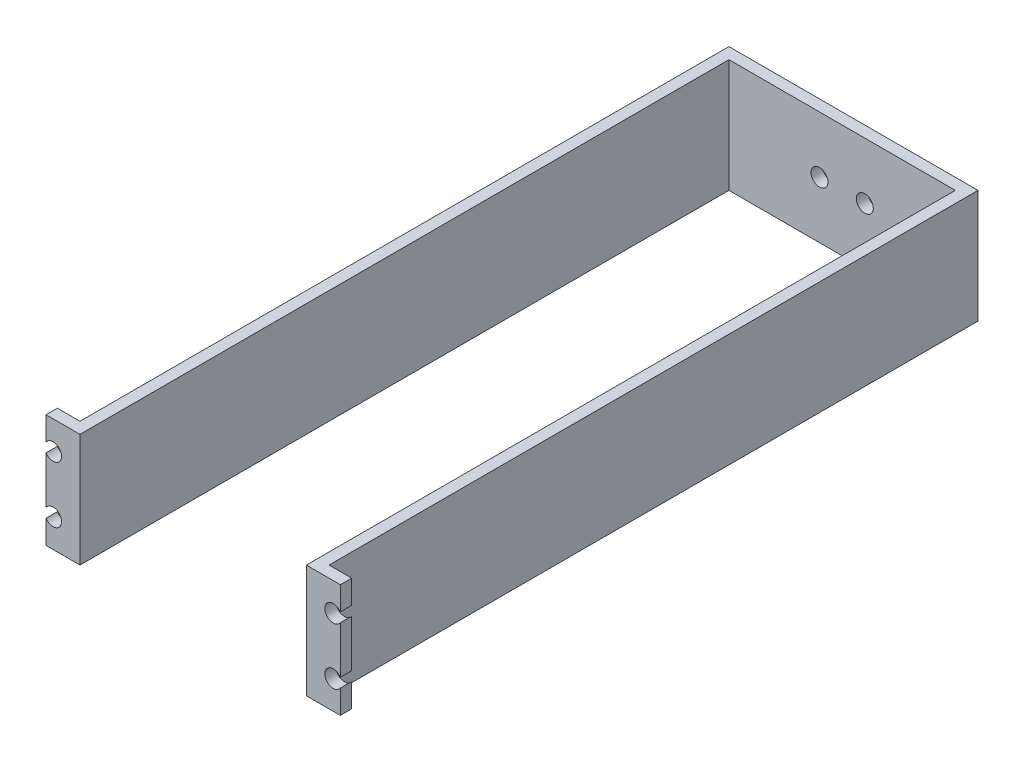
from build123d import *

# Parameters (mm, degrees)
ESQUISSE1_W             = 44
ESQUISSE1_H             = 20
BOSS_EXTRU_1_DEPTH      = 2
ESQUISSE2_W             = 2
ESQUISSE2_H             = 20
BOSS_EXTRU_2_DEPTH      = 114.65
ESQUISSE3_W             = 2
ESQUISSE3_H             = 20
BOSS_EXTRU_3_DEPTH      = 4
ESQUISSE4_W             = 2
ESQUISSE4_H             = 20
BOSS_EXTRU_4_DEPTH      = 4
ESQUISSE5_R             = 1.5
ENL_V_MAT_EXTRU_1_DEPTH = 4
ESQUISSE6_R             = 1.5
ENL_V_MAT_EXTRU_2_DEPTH = 4


with BuildPart() as part:
    # Esquisse1 → Boss.-Extru.1 (new body)
    with BuildSketch(Plane.XY):
        with Locations((22, 10)):
            Rectangle(ESQUISSE1_W, ESQUISSE1_H)
    extrude(amount=BOSS_EXTRU_1_DEPTH)

    # Esquisse2 → Boss.-Extru.2 (add)
    with BuildSketch(Plane.XY.offset(2)):
        with Locations((1, 10)):
            Rectangle(ESQUISSE2_W, ESQUISSE2_H)
        with Locations((43, 10)):
            Rectangle(ESQUISSE2_W, ESQUISSE2_H)
    extrude(amount=BOSS_EXTRU_2_DEPTH)

    # Esquisse3 → Boss.-Extru.3 (add)
    with BuildSketch(Plane.ZY):
        with Locations((115.65, 10)):
            Rectangle(ESQUISSE3_W, ESQUISSE3_H)
    extrude(amount=BOSS_EXTRU_3_DEPTH)

    # Esquisse4 → Boss.-Extru.4 (add)
    with BuildSketch(Plane(origin=(44, 0, 0), x_dir=(0, 0, -1), z_dir=(1, 0, 0))):
        with Locations((-115.65, 10)):
            Rectangle(ESQUISSE4_W, ESQUISSE4_H)
    extrude(amount=BOSS_EXTRU_4_DEPTH)

    # Esquisse5 → Enlèv. mat.-Extru.1 (cut)
    with BuildSketch(Plane.XY.offset(2)):
        with Locations((18, 10)):
            Circle(ESQUISSE5_R)
        with Locations((26, 10)):
            Circle(ESQUISSE5_R)
    extrude(amount=-ENL_V_MAT_EXTRU_1_DEPTH, mode=Mode.SUBTRACT)

    # Esquisse6 → Enlèv. mat.-Extru.2 (cut)
    with BuildSketch(Plane.XY.offset(116.65)):
        with Locations((46.75, 15)):
            Circle(ESQUISSE6_R)
        with Locations((46.75, 5)):
            Circle(ESQUISSE6_R)
        with Locations((-2.75, 15)):
            Circle(ESQUISSE6_R)
        with Locations((-2.75, 5)):
            Circle(ESQUISSE6_R)
    extrude(amount=-ENL_V_MAT_EXTRU_2_DEPTH, mode=Mode.SUBTRACT)


solid = part.part
